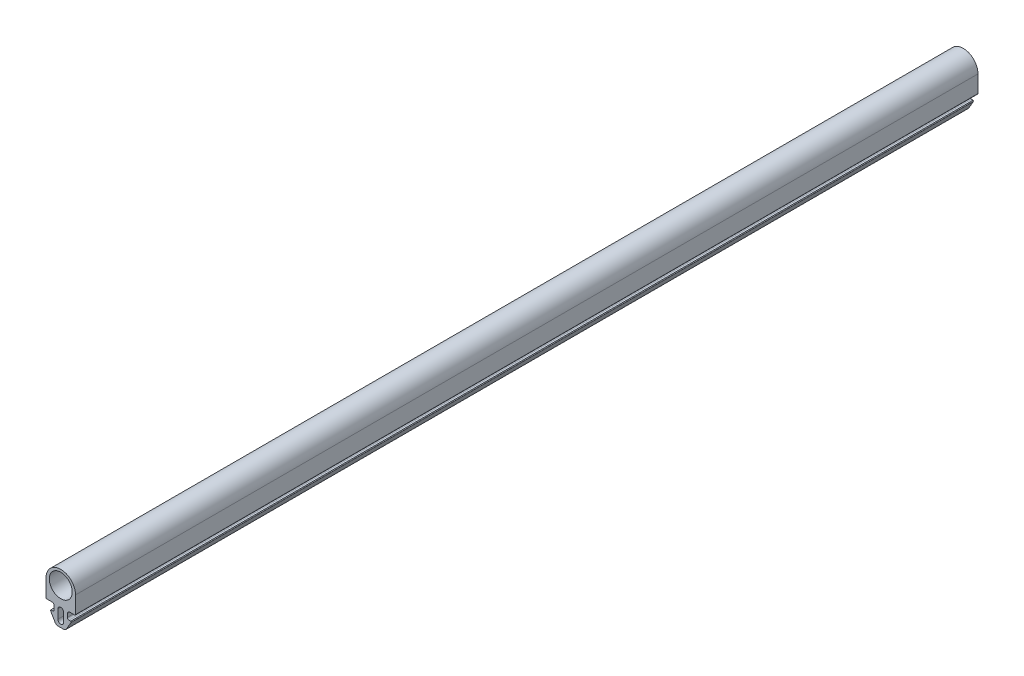
from build123d import *

# Parameters (mm, degrees)
ESQUISSE1_R        = 7
BOSS_EXTRU_1_DEPTH = 550


with BuildPart() as part:
    # Esquisse1 → Boss.-Extru.1 (new body)
    with BuildSketch(Plane.XY.offset(20)):
        with BuildLine():
            Line((-9, 10.864586864), (-9, 0.523924837))
            ThreePointArc((-9, 0.523924837), (-8.854824532, 0.14661401), (-8.478070356, 0))
            Line((-8.478070356, 0), (-5.5, 0))
            ThreePointArc((-5.5, 0), (-4.439339828, -0.439339828), (-4, -1.5))
            Line((-4, -1.5), (-4, -3.5))
            ThreePointArc((-4, -3.5), (-4.292893219, -4.207106781), (-5, -4.5))
            Line((-5, -4.5), (-6.016007613, -4.5))
            ThreePointArc((-6.016007613, -4.5), (-6.227713349, -4.802430523), (-6.174193657, -5.16769643))
            Line((-6.174193657, -5.16769643), (-3.440043573, -9.90338329))
            ThreePointArc((-3.440043573, -9.90338329), (-2.707992766, -10.635434098), (-1.707992766, -10.90338329))
            Line((-1.707992766, -10.90338329), (1.707992766, -10.90338329))
            ThreePointArc((1.707992766, -10.90338329), (2.707992766, -10.635434098), (3.440043573, -9.90338329))
            Line((3.440043573, -9.90338329), (6.174193657, -5.16769643))
            ThreePointArc((6.174193657, -5.16769643), (6.227713349, -4.802430523), (6.016007614, -4.5))
            Line((6.016007614, -4.5), (5, -4.5))
            ThreePointArc((5, -4.5), (4.292893219, -4.207106781), (4, -3.5))
            Line((4, -3.5), (4, -1.5))
            ThreePointArc((4, -1.5), (4.439339828, -0.439339828), (5.5, 0))
            Line((5.5, 0), (8.478070356, 0))
            ThreePointArc((8.478070356, 0), (8.854824532, 0.14661401), (9, 0.523924837))
            Line((9, 0.523924837), (9, 10.864586864))
            ThreePointArc((9, 10.864586864), (0, 19.864586864), (-9, 10.864586864))
        make_face()
        with Locations(Location((0, 11.36, 0), (0, 0, 180))):
            Circle(ESQUISSE1_R, mode=Mode.SUBTRACT)
        with BuildLine():
            Line((1.75, -1.95338329), (1.75, -7.351528839))
            ThreePointArc((1.75, -7.351528839), (0, -9.101528839), (-1.75, -7.351528839))
            Line((-1.75, -7.351528839), (-1.75, -1.95338329))
            ThreePointArc((-1.75, -1.95338329), (0, -0.20338329), (1.75, -1.95338329))
        make_face(mode=Mode.SUBTRACT)
    extrude(amount=-BOSS_EXTRU_1_DEPTH)


solid = part.part
